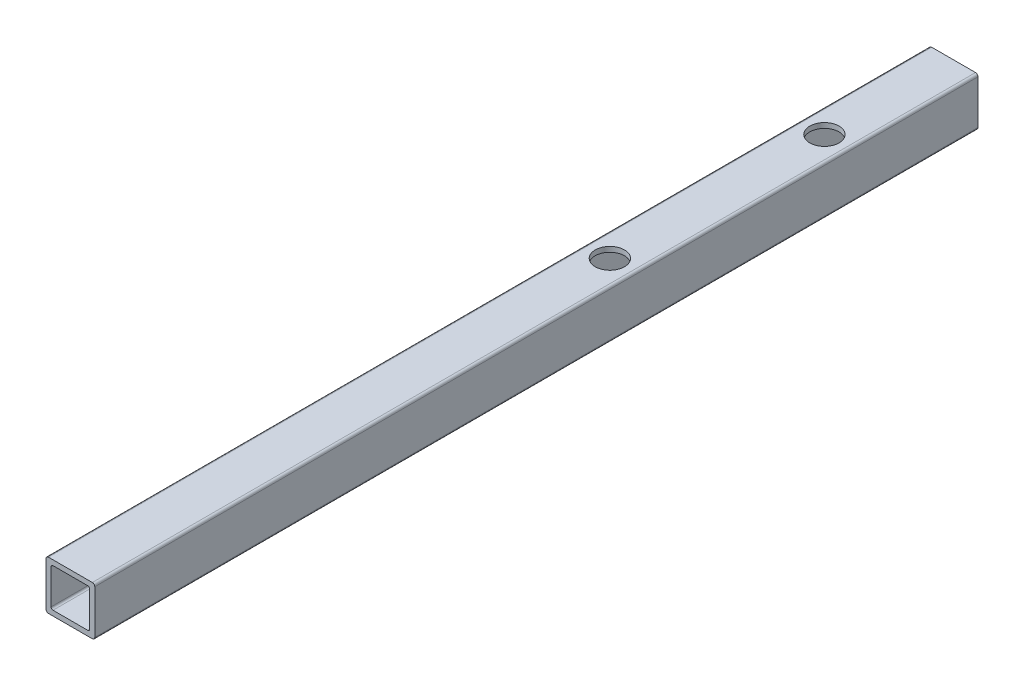
from build123d import *

# Parameters (mm, degrees)
BOSS_EXTRUDE1_DEPTH          = 457.2
BOSS_EXTRUDE1_DEPTH_BACK     = 457.2
F_3_8_0_375_DIAMETER_HOLE1_D = 9.525
F_3_8_0_375_DIAMETER_HOLE2_D = 9.525
SKETCH10_W                   = 777.465907107
SKETCH10_H                   = 78.912238835
CUT_EXTRUDE1_DEPTH           = 33.02


with BuildPart() as part:
    # Sketch4 → Boss-Extrude1 (new, two sides: drawn at the far end of the back side and taken through both)
    with BuildSketch(Plane.XY.offset(-BOSS_EXTRUDE1_DEPTH_BACK)):
        with BuildLine():
            Line((7.9375, -7.14375), (7.9375, 7.14375))
            ThreePointArc((7.9375, 7.14375), (7.705016008, 7.705016008), (7.14375, 7.9375))
            Line((7.14375, 7.9375), (-7.14375, 7.9375))
            ThreePointArc((-7.14375, 7.9375), (-7.705016008, 7.705016008), (-7.9375, 7.14375))
            Line((-7.9375, 7.14375), (-7.9375, -7.14375))
            ThreePointArc((-7.9375, -7.14375), (-7.705016008, -7.705016008), (-7.14375, -7.9375))
            Line((-7.14375, -7.9375), (7.14375, -7.9375))
            ThreePointArc((7.14375, -7.9375), (7.705016008, -7.705016008), (7.9375, -7.14375))
        make_face()
        with BuildLine():
            Line((6.2865, 5.65785), (6.2865, -5.65785))
            ThreePointArc((6.2865, -5.65785), (6.102372678, -6.102372678), (5.65785, -6.2865))
            Line((5.65785, -6.2865), (-5.65785, -6.2865))
            ThreePointArc((-5.65785, -6.2865), (-6.102372678, -6.102372678), (-6.2865, -5.65785))
            Line((-6.2865, -5.65785), (-6.2865, 5.65785))
            ThreePointArc((-6.2865, 5.65785), (-6.102372678, 6.102372678), (-5.65785, 6.2865))
            Line((-5.65785, 6.2865), (5.65785, 6.2865))
            ThreePointArc((5.65785, 6.2865), (6.102372678, 6.102372678), (6.2865, 5.65785))
        make_face(mode=Mode.SUBTRACT)
    extrude(amount=BOSS_EXTRUDE1_DEPTH + BOSS_EXTRUDE1_DEPTH_BACK)

    # 3/8 (0.375) Diameter Hole1 (through all)
    with Locations(Plane(origin=(0, -7.9375, 0), x_dir=(-1, 0, 0), z_dir=(0, -1, 0))):
        with Locations((0, 415.13125)):
            Hole(F_3_8_0_375_DIAMETER_HOLE1_D / 2)

    # 3/8 (0.375) Diameter Hole2 (through all)
    with Locations(Plane(origin=(0, 7.9375, 0), x_dir=(1, 0, 0), z_dir=(0, 1, 0))):
        with Locations((0, 345.28125)):
            Hole(F_3_8_0_375_DIAMETER_HOLE2_D / 2)

    # Sketch10 → Cut-Extrude1 (cut)
    with BuildSketch(Plane.ZY.offset(7.9375)):
        with Locations((219.099444852, 1.446775725)):
            Rectangle(SKETCH10_W, SKETCH10_H)
    extrude(amount=-CUT_EXTRUDE1_DEPTH, mode=Mode.SUBTRACT)


solid = part.part
